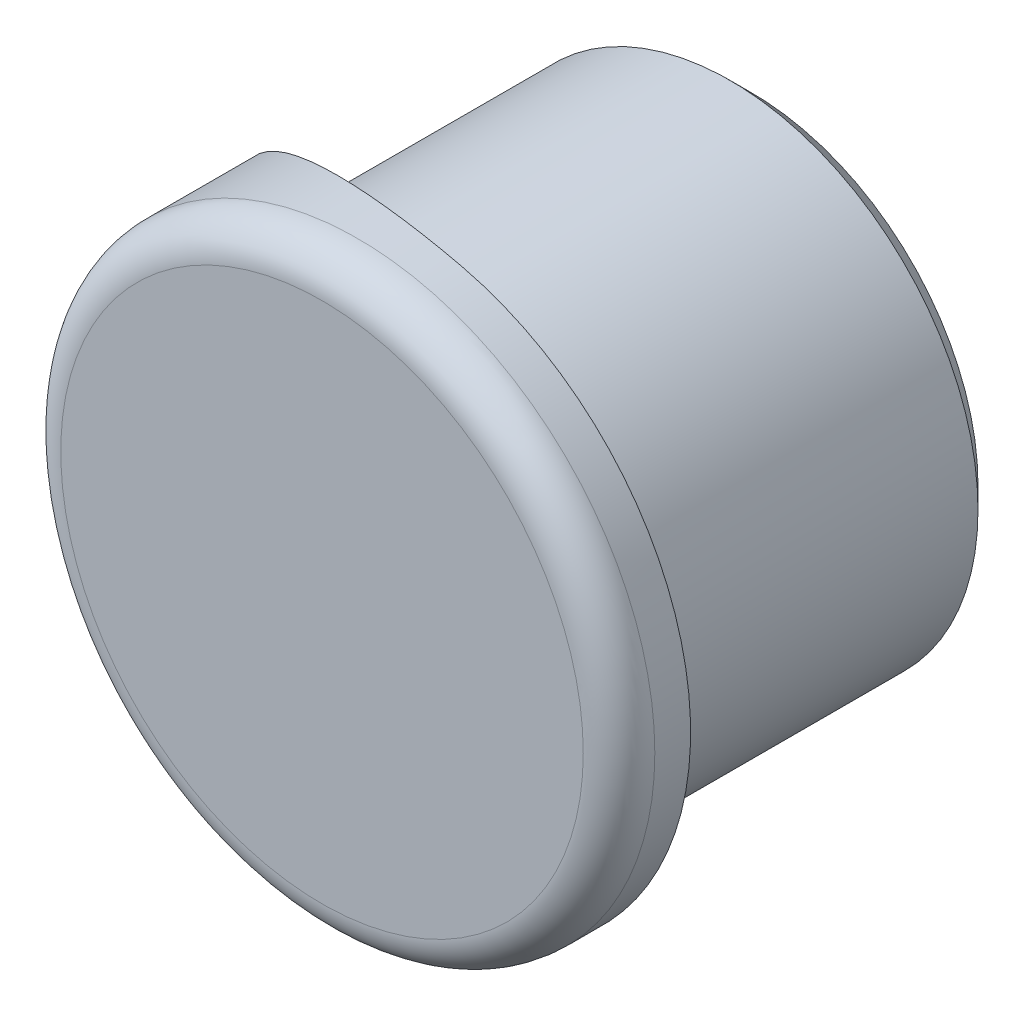
from build123d import *

# Parameters (mm, degrees)
ESQUISSE1_R                  = 3.465
BOSS_EXTRU_1_DEPTH           = 5
ESQUISSE2_R                  = 4.15
BOSS_EXTRU_2_DEPTH           = 1
CONG_1_R                     = 0.5
BOSS_EXTRU_3_DEPTH           = 9
BOSS_EXTRU_3_DEPTH_BACK      = 2
ENL_V_START                  = -4
ENL_V_MAT_EXTRU_1_DEPTH      = 4
CHANFREIN1_SIZE              = 0.3
ENL_V_MAT_EXTRU_2_REACH      = 84.915
ENL_V_MAT_EXTRU_2_END_RADIUS = 8


with BuildPart() as part:
    # Esquisse1 → Boss.-Extru.1 (new body)
    with BuildSketch(Plane.XY):
        with Locations((-38, 67)):
            Circle(ESQUISSE1_R)
    extrude(amount=-BOSS_EXTRU_1_DEPTH)

    # Esquisse2 → Boss.-Extru.2 (add)
    with BuildSketch(Plane.XY):
        with Locations((-38, 67)):
            Circle(ESQUISSE2_R)
    extrude(amount=BOSS_EXTRU_2_DEPTH)

    # Congé1
    cong_1_edges = [part.edges().sort_by_distance(p)[0] for p in [
        (-42.15, 67, 1),
    ]]
    fillet(cong_1_edges, radius=CONG_1_R)

    # Esquisse4 → Boss.-Extru.3 (add, two sides: drawn at the far end of the back side and taken through both)
    with BuildSketch(Plane(origin=(29.785, 71.15, 0), x_dir=(0, 0, 1), z_dir=(0, -1, 0)).offset(-BOSS_EXTRU_3_DEPTH_BACK)):
        with BuildLine():
            Line((0, 71.935), (-1.84883954, 71.935))
            ThreePointArc((-1.84883954, 71.935), (-0.476394359, 69.539440781), (0, 66.82))
            Line((0, 66.82), (0, 71.935))
        make_face()
    extrude(amount=BOSS_EXTRU_3_DEPTH + BOSS_EXTRU_3_DEPTH_BACK)

    # Esquisse5 → Enlèv. mat.-Extru.1 (cut)
    with BuildSketch(Plane.XY.offset(1).offset(ENL_V_START)):
        with BuildLine():
            Line((-37.035, 62.963754839), (-36.628505561, 58.672971398))
            Line((-36.628505561, 58.672971398), (-43.808246532, 59.466119951))
            Line((-43.808246532, 59.466119951), (-42.997006725, 73.486489438))
            Line((-42.997006725, 73.486489438), (-36.628505561, 73.524507843))
            Line((-36.628505561, 73.524507843), (-37.035, 71.036245161))
            ThreePointArc((-37.035, 71.036245161), (-40.57077323, 70.25785589), (-42.15, 67))
            ThreePointArc((-42.15, 67), (-40.57077323, 63.74214411), (-37.035, 62.963754839))
        make_face()
    extrude(amount=ENL_V_MAT_EXTRU_1_DEPTH, mode=Mode.SUBTRACT)

    # Chanfrein1
    chanfrein1_edges = [part.edges().sort_by_distance(p)[0] for p in [
        (-41.465, 67, -5),
    ]]
    chamfer(chanfrein1_edges, length=CHANFREIN1_SIZE)

    # Enlèv. mat.-Extru.2: up to this cylinder (the profile starts inside it)
    enl_v_mat_extru_2_end = Plane(origin=(-37.035, 63.684684, -8), z_dir=(0, -1, 0)) * Cylinder(ENL_V_MAT_EXTRU_2_END_RADIUS, 186.83, mode=Mode.PRIVATE)
    # Esquisse7 → Enlèv. mat.-Extru.2 (cut, up to the surface)
    with BuildSketch(Plane(origin=(0, 0, -5), x_dir=(-1, 0, 0), z_dir=(0, 0, -1)), mode=Mode.PRIVATE) as enl_v_mat_extru_2_sk1:
        with BuildLine():
            Line((36.707715202, 63.785), (39.292284798, 63.785))
            ThreePointArc((39.292284798, 63.785), (38, 63.535), (36.707715202, 63.785))
        make_face()
    enl_v_mat_extru_2_tool1 = extrude(enl_v_mat_extru_2_sk1.sketch, amount=-ENL_V_MAT_EXTRU_2_REACH, mode=Mode.PRIVATE) & enl_v_mat_extru_2_end
    add(enl_v_mat_extru_2_tool1.solids().sort_by_distance((-38, 63.684684, -5))[0], mode=Mode.SUBTRACT)


solid = part.part
